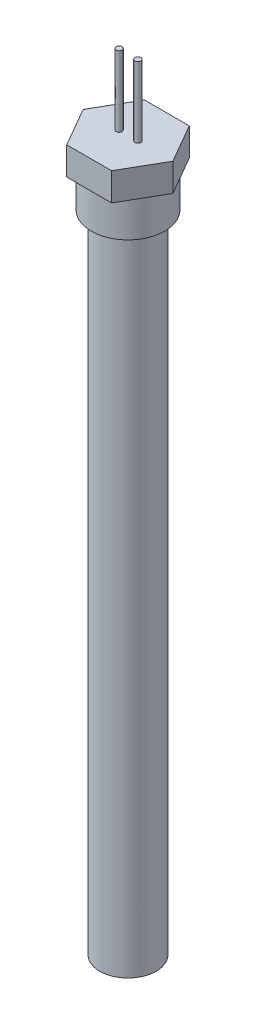
from build123d import *

# Parameters (mm, degrees)
SKETCH1_R           = 8
BOSS_EXTRUDE1_DEPTH = 201
SKETCH2_R           = 0.828373934
SKETCH2_R_2         = 0.842670195
BOSS_EXTRUDE2_DEPTH = 20
BOSS_EXTRUDE3_DEPTH = 7.9
BOSS_EXTRUDE4_START = 10.4
SKETCH4_R           = 10.4
SKETCH4_R_2         = 8
BOSS_EXTRUDE4_DEPTH = 10.4


with BuildPart() as part:
    # Sketch1 → Boss-Extrude1 (new body)
    with BuildSketch(Plane(origin=(0, 0, 0), x_dir=(1, 0, 0), z_dir=(0, 1, 0))):
        with Locations(Location((0, 0, 0), (0, 0, 270))):
            Circle(SKETCH1_R)
    extrude(amount=BOSS_EXTRUDE1_DEPTH)

    # Sketch2 → Boss-Extrude2 (add)
    with BuildSketch(Plane(origin=(0, 201, 0), x_dir=(1, 0, 0), z_dir=(0, 1, 0))):
        with Locations(Location((-2.575042815, 0.066667775, 0), (0, 0, 270))):
            Circle(SKETCH2_R)
        with Locations(Location((2.750045724, 0.066667775, 0), (0, 0, 270))):
            Circle(SKETCH2_R_2)
    extrude(amount=BOSS_EXTRUDE2_DEPTH)

    # Sketch3 → Boss-Extrude3 (add)
    with BuildSketch(Plane(origin=(0, 201, 0), x_dir=(1, 0, 0), z_dir=(0, 1, 0))):
        Polygon((12.701705922, 0), (6.350852961, 11), (-6.350852961, 11), (-12.701705922, 0), (-6.350852961, -11), (6.350852961, -11), align=None)
    extrude(amount=-BOSS_EXTRUDE3_DEPTH)

    # Sketch4 → Boss-Extrude4 (add)
    with BuildSketch(Plane.XZ.offset(-193.1).offset(BOSS_EXTRUDE4_START)):
        with Locations(Location((0, 0, 0), (0, 0, 90))):
            Circle(SKETCH4_R)
        with Locations(Location((0, 0, 0), (0, 0, 270))):
            Circle(SKETCH4_R_2, mode=Mode.SUBTRACT)
    extrude(amount=-BOSS_EXTRUDE4_DEPTH)


solid = part.part
